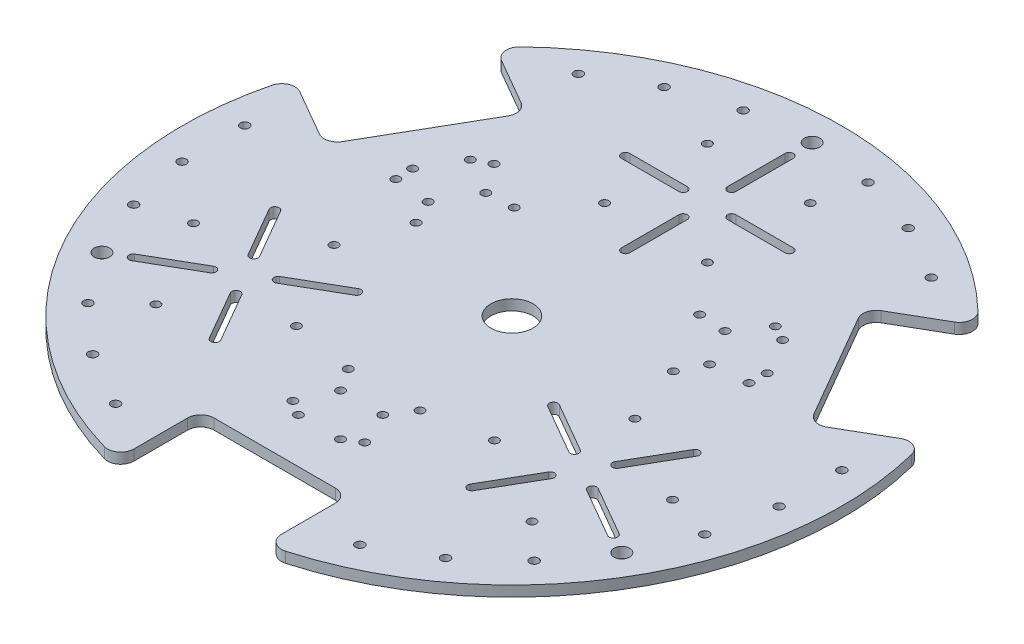
from build123d import *

# Parameters (mm, degrees)
SKETCH1_R           = 8
SKETCH1_R_2         = 2.95
SKETCH1_R_3         = 1.675
SKETCH1_R_4         = 1.6
BOSS_EXTRUDE2_DEPTH = 4
FILLET1_R           = 5


with BuildPart() as part:
    # Sketch1 → Boss-Extrude2 (new body)
    with BuildSketch(Plane(origin=(0, 0, 0), x_dir=(1, 0, 0), z_dir=(0, 1, 0))):
        with BuildLine():
            Line((-89.442286341, 25.081415713), (-66.442286341, 64.918584287))
            ThreePointArc((-66.442286341, 64.918584287), (-65.942784228, 68.712679513), (-68.27241336, 71.748711306))
            Line((-68.27241336, 71.748711306), (-91.502369642, 85.160532819))
            ThreePointArc((-91.502369642, 85.160532819), (0, 125), (91.502369642, 85.160532819))
            Line((91.502369642, 85.160532819), (68.27241336, 71.748711306))
            ThreePointArc((68.27241336, 71.748711306), (65.942784228, 68.712679513), (66.442286341, 64.918584287))
            Line((66.442286341, 64.918584287), (89.442286341, 25.081415713))
            ThreePointArc((89.442286341, 25.081415713), (92.478318134, 22.751786582), (96.27241336, 23.251288694))
            Line((96.27241336, 23.251288694), (119.502369642, 36.663110207))
            ThreePointArc((119.502369642, 36.663110207), (108.253175473, -62.5), (28, -121.823643025))
            Line((28, -121.823643025), (28, -95))
            ThreePointArc((28, -95), (26.535533906, -91.464466094), (23, -90))
            Line((23, -90), (-23, -90))
            ThreePointArc((-23, -90), (-26.535533906, -91.464466094), (-28, -95))
            Line((-28, -95), (-28, -121.823643025))
            ThreePointArc((-28, -121.823643025), (-108.253175473, -62.5), (-119.502369642, 36.663110207))
            Line((-119.502369642, 36.663110207), (-96.27241336, 23.251288694))
            ThreePointArc((-96.27241336, 23.251288694), (-92.478318134, 22.751786582), (-89.442286341, 25.081415713))
        make_face()
        with Locations(Location((0, 0, 0), (0, 0, 270))):
            Circle(SKETCH1_R, mode=Mode.SUBTRACT)
        with Locations(Location((0, 113.85, 0), (0, 0, 270))):
            Circle(SKETCH1_R_2, mode=Mode.SUBTRACT)
        with Locations(Location((98.596992221, -56.925, 0), (0, 0, 270))):
            Circle(SKETCH1_R_2, mode=Mode.SUBTRACT)
        with Locations(Location((-98.596992221, -56.925, 0), (0, 0, 270))):
            Circle(SKETCH1_R_2, mode=Mode.SUBTRACT)
        with Locations(Location((23.670746, 111.362104344, 0), (0, 0, 270))):
            Circle(SKETCH1_R_3, mode=Mode.SUBTRACT)
        with Locations(Location((46.306966814, 104.007150353, 0), (0, 0, 270))):
            Circle(SKETCH1_R_3, mode=Mode.SUBTRACT)
        with Locations(Location((66.919350973, 92.10658481, 0), (0, 0, 270))):
            Circle(SKETCH1_R_3, mode=Mode.SUBTRACT)
        with Locations(Location((113.226317788, 11.900565543, 0), (0, 0, 270))):
            Circle(SKETCH1_R_3, mode=Mode.SUBTRACT)
        with Locations(Location((113.226317788, -11.900565543, 0), (0, 0, 270))):
            Circle(SKETCH1_R_3, mode=Mode.SUBTRACT)
        with Locations(Location((108.27778438, -35.18158481, 0), (0, 0, 270))):
            Circle(SKETCH1_R_3, mode=Mode.SUBTRACT)
        with Locations(Location((84.607038381, -76.180519534, 0), (0, 0, 270))):
            Circle(SKETCH1_R_3, mode=Mode.SUBTRACT)
        with Locations(Location((66.919350974, -92.10658481, 0), (0, 0, 270))):
            Circle(SKETCH1_R_3, mode=Mode.SUBTRACT)
        with Locations(Location((46.306966814, -104.007150353, 0), (0, 0, 270))):
            Circle(SKETCH1_R_3, mode=Mode.SUBTRACT)
        with Locations(Location((-46.306966814, -104.007150353, 0), (0, 0, 270))):
            Circle(SKETCH1_R_3, mode=Mode.SUBTRACT)
        with Locations(Location((-66.919350973, -92.10658481, 0), (0, 0, 270))):
            Circle(SKETCH1_R_3, mode=Mode.SUBTRACT)
        with Locations(Location((-84.607038381, -76.180519534, 0), (0, 0, 270))):
            Circle(SKETCH1_R_3, mode=Mode.SUBTRACT)
        with Locations(Location((-108.27778438, -35.18158481, 0), (0, 0, 270))):
            Circle(SKETCH1_R_3, mode=Mode.SUBTRACT)
        with Locations(Location((-113.226317788, -11.900565543, 0), (0, 0, 270))):
            Circle(SKETCH1_R_3, mode=Mode.SUBTRACT)
        with Locations(Location((-113.226317788, 11.900565543, 0), (0, 0, 270))):
            Circle(SKETCH1_R_3, mode=Mode.SUBTRACT)
        with Locations(Location((-66.919350973, 92.10658481, 0), (0, 0, 270))):
            Circle(SKETCH1_R_3, mode=Mode.SUBTRACT)
        with Locations(Location((-46.306966814, 104.007150353, 0), (0, 0, 270))):
            Circle(SKETCH1_R_3, mode=Mode.SUBTRACT)
        with Locations(Location((-23.670746, 111.362104344, 0), (0, 0, 270))):
            Circle(SKETCH1_R_3, mode=Mode.SUBTRACT)
        with Locations(Location((-90.831628429, -29.925004626, 0), (0, 0, 270))):
            Circle(SKETCH1_R_4, mode=Mode.SUBTRACT)
        with Locations(Location((-57.056637682, -10.425004626, 0), (0, 0, 270))):
            Circle(SKETCH1_R_4, mode=Mode.SUBTRACT)
        with Locations(Location((-37.556637682, -44.199995374, 0), (0, 0, 270))):
            Circle(SKETCH1_R_4, mode=Mode.SUBTRACT)
        with Locations(Location((-71.331628429, -63.699995374, 0), (0, 0, 270))):
            Circle(SKETCH1_R_4, mode=Mode.SUBTRACT)
        with Locations(Location((19.5, 93.625, 0), (0, 0, 270))):
            Circle(SKETCH1_R_4, mode=Mode.SUBTRACT)
        with Locations(Location((19.5, 54.625, 0), (0, 0, 270))):
            Circle(SKETCH1_R_4, mode=Mode.SUBTRACT)
        with Locations(Location((-19.5, 54.625, 0), (0, 0, 270))):
            Circle(SKETCH1_R_4, mode=Mode.SUBTRACT)
        with Locations(Location((-19.5, 93.625, 0), (0, 0, 270))):
            Circle(SKETCH1_R_4, mode=Mode.SUBTRACT)
        with Locations(Location((71.331628429, -63.699995374, 0), (0, 0, 270))):
            Circle(SKETCH1_R_4, mode=Mode.SUBTRACT)
        with Locations(Location((37.556637682, -44.199995374, 0), (0, 0, 270))):
            Circle(SKETCH1_R_4, mode=Mode.SUBTRACT)
        with Locations(Location((57.056637682, -10.425004626, 0), (0, 0, 270))):
            Circle(SKETCH1_R_4, mode=Mode.SUBTRACT)
        with Locations(Location((90.831628429, -29.925004626, 0), (0, 0, 270))):
            Circle(SKETCH1_R_4, mode=Mode.SUBTRACT)
        with Locations(Location((-13.625, -48.465, 0), (0, 0, 270))):
            Circle(SKETCH1_R_4, mode=Mode.SUBTRACT)
        with Locations(Location((13.625, -48.465, 0), (0, 0, 270))):
            Circle(SKETCH1_R_4, mode=Mode.SUBTRACT)
        with Locations(Location((13.625, -69.465, 0), (0, 0, 270))):
            Circle(SKETCH1_R_4, mode=Mode.SUBTRACT)
        with Locations(Location((-13.625, -69.465, 0), (0, 0, 270))):
            Circle(SKETCH1_R_4, mode=Mode.SUBTRACT)
        with Locations(Location((-35.159421194, 36.032096127, 0), (0, 0, 270))):
            Circle(SKETCH1_R_4, mode=Mode.SUBTRACT)
        with Locations(Location((-48.784421194, 12.432903873, 0), (0, 0, 270))):
            Circle(SKETCH1_R_4, mode=Mode.SUBTRACT)
        with Locations(Location((-66.970954674, 22.932903873, 0), (0, 0, 270))):
            Circle(SKETCH1_R_4, mode=Mode.SUBTRACT)
        with Locations(Location((-53.345954674, 46.532096127, 0), (0, 0, 270))):
            Circle(SKETCH1_R_4, mode=Mode.SUBTRACT)
        with Locations(Location((48.784421194, 12.432903873, 0), (0, 0, 270))):
            Circle(SKETCH1_R_4, mode=Mode.SUBTRACT)
        with Locations(Location((35.159421194, 36.032096127, 0), (0, 0, 270))):
            Circle(SKETCH1_R_4, mode=Mode.SUBTRACT)
        with Locations(Location((53.345954674, 46.532096127, 0), (0, 0, 270))):
            Circle(SKETCH1_R_4, mode=Mode.SUBTRACT)
        with Locations(Location((66.970954674, 22.932903873, 0), (0, 0, 270))):
            Circle(SKETCH1_R_4, mode=Mode.SUBTRACT)
        with Locations(Location((-8, -73, 0), (0, 0, 270))):
            Circle(SKETCH1_R_4, mode=Mode.SUBTRACT)
        with Locations(Location((-8, -57, 0), (0, 0, 270))):
            Circle(SKETCH1_R_4, mode=Mode.SUBTRACT)
        with Locations(Location((8, -57, 0), (0, 0, 270))):
            Circle(SKETCH1_R_4, mode=Mode.SUBTRACT)
        with Locations(Location((8, -73, 0), (0, 0, 270))):
            Circle(SKETCH1_R_4, mode=Mode.SUBTRACT)
        with Locations(Location((-59.219854476, 43.42820323, 0), (0, 0, 270))):
            Circle(SKETCH1_R_4, mode=Mode.SUBTRACT)
        with Locations(Location((-45.363448016, 35.42820323, 0), (0, 0, 270))):
            Circle(SKETCH1_R_4, mode=Mode.SUBTRACT)
        with Locations(Location((-53.363448016, 21.57179677, 0), (0, 0, 270))):
            Circle(SKETCH1_R_4, mode=Mode.SUBTRACT)
        with Locations(Location((-67.219854476, 29.57179677, 0), (0, 0, 270))):
            Circle(SKETCH1_R_4, mode=Mode.SUBTRACT)
        with Locations(Location((67.219854476, 29.57179677, 0), (0, 0, 270))):
            Circle(SKETCH1_R_4, mode=Mode.SUBTRACT)
        with Locations(Location((53.363448016, 21.57179677, 0), (0, 0, 270))):
            Circle(SKETCH1_R_4, mode=Mode.SUBTRACT)
        with Locations(Location((45.363448016, 35.42820323, 0), (0, 0, 270))):
            Circle(SKETCH1_R_4, mode=Mode.SUBTRACT)
        with Locations(Location((59.219854476, 43.42820323, 0), (0, 0, 270))):
            Circle(SKETCH1_R_4, mode=Mode.SUBTRACT)
        with BuildLine():
            Line((-71.383217405, -43.060640646), (-90.262571208, -53.960640646))
            ThreePointArc((-90.262571208, -53.960640646), (-92.448211854, -53.375), (-91.862571208, -51.189359354))
            Line((-91.862571208, -51.189359354), (-72.983217405, -40.289359354))
            ThreePointArc((-72.983217405, -40.289359354), (-70.797576759, -40.875), (-71.383217405, -43.060640646))
        make_face(mode=Mode.SUBTRACT)
        with BuildLine():
            Line((-70.192273702, -29.87341565), (-81.092273702, -10.994061848))
            ThreePointArc((-81.092273702, -10.994061848), (-80.506633056, -8.808421202), (-78.320992409, -9.394061848))
            Line((-78.320992409, -9.394061848), (-67.420992409, -28.27341565))
            ThreePointArc((-67.420992409, -28.27341565), (-68.006633056, -30.459056296), (-70.192273702, -29.87341565))
        make_face(mode=Mode.SUBTRACT)
        with BuildLine():
            Line((-57.005048706, -31.064359354), (-38.125694903, -20.164359354))
            ThreePointArc((-38.125694903, -20.164359354), (-35.940054257, -20.75), (-36.525694903, -22.935640646))
            Line((-36.525694903, -22.935640646), (-55.405048706, -33.835640646))
            ThreePointArc((-55.405048706, -33.835640646), (-57.590689352, -33.25), (-57.005048706, -31.064359354))
        make_face(mode=Mode.SUBTRACT)
        with BuildLine():
            Line((-58.195992409, -44.25158435), (-47.295992409, -63.130938152))
            ThreePointArc((-47.295992409, -63.130938152), (-47.881633056, -65.316578798), (-50.067273702, -64.730938152))
            Line((-50.067273702, -64.730938152), (-60.967273702, -45.85158435))
            ThreePointArc((-60.967273702, -45.85158435), (-60.381633056, -43.665943704), (-58.195992409, -44.25158435))
        make_face(mode=Mode.SUBTRACT)
        with BuildLine():
            Line((-1.6, 83.35), (-1.6, 105.15))
            ThreePointArc((-1.6, 105.15), (0, 106.75), (1.6, 105.15))
            Line((1.6, 105.15), (1.6, 83.35))
            ThreePointArc((1.6, 83.35), (0, 81.75), (-1.6, 83.35))
        make_face(mode=Mode.SUBTRACT)
        with BuildLine():
            Line((-1.6, 43.1), (-1.6, 64.9))
            ThreePointArc((-1.6, 64.9), (0, 66.5), (1.6, 64.9))
            Line((1.6, 64.9), (1.6, 43.1))
            ThreePointArc((1.6, 43.1), (0, 41.5), (-1.6, 43.1))
        make_face(mode=Mode.SUBTRACT)
        with BuildLine():
            Line((9.225, 75.725), (31.025, 75.725))
            ThreePointArc((31.025, 75.725), (32.625, 74.125), (31.025, 72.525))
            Line((31.025, 72.525), (9.225, 72.525))
            ThreePointArc((9.225, 72.525), (7.625, 74.125), (9.225, 75.725))
        make_face(mode=Mode.SUBTRACT)
        with BuildLine():
            Line((-9.225, 72.525), (-31.025, 72.525))
            ThreePointArc((-31.025, 72.525), (-32.625, 74.125), (-31.025, 75.725))
            Line((-31.025, 75.725), (-9.225, 75.725))
            ThreePointArc((-9.225, 75.725), (-7.625, 74.125), (-9.225, 72.525))
        make_face(mode=Mode.SUBTRACT)
        with BuildLine():
            Line((72.983217405, -40.289359354), (91.862571208, -51.189359354))
            ThreePointArc((91.862571208, -51.189359354), (92.448211854, -53.375), (90.262571208, -53.960640646))
            Line((90.262571208, -53.960640646), (71.383217405, -43.060640646))
            ThreePointArc((71.383217405, -43.060640646), (70.797576759, -40.875), (72.983217405, -40.289359354))
        make_face(mode=Mode.SUBTRACT)
        with BuildLine():
            Line((38.125694903, -20.164359354), (57.005048706, -31.064359354))
            ThreePointArc((57.005048706, -31.064359354), (57.590689352, -33.25), (55.405048706, -33.835640646))
            Line((55.405048706, -33.835640646), (36.525694903, -22.935640646))
            ThreePointArc((36.525694903, -22.935640646), (35.940054257, -20.75), (38.125694903, -20.164359354))
        make_face(mode=Mode.SUBTRACT)
        with BuildLine():
            Line((60.967273702, -45.85158435), (50.067273702, -64.730938152))
            ThreePointArc((50.067273702, -64.730938152), (47.881633056, -65.316578798), (47.295992409, -63.130938152))
            Line((47.295992409, -63.130938152), (58.195992409, -44.25158435))
            ThreePointArc((58.195992409, -44.25158435), (60.381633056, -43.665943704), (60.967273702, -45.85158435))
        make_face(mode=Mode.SUBTRACT)
        with BuildLine():
            Line((67.420992409, -28.27341565), (78.320992409, -9.394061848))
            ThreePointArc((78.320992409, -9.394061848), (80.506633056, -8.808421202), (81.092273702, -10.994061848))
            Line((81.092273702, -10.994061848), (70.192273702, -29.87341565))
            ThreePointArc((70.192273702, -29.87341565), (68.006633056, -30.459056296), (67.420992409, -28.27341565))
        make_face(mode=Mode.SUBTRACT)
    extrude(amount=BOSS_EXTRUDE2_DEPTH)

    # Fillet1
    fillet1_edges = [part.edges().sort_by_distance(p)[0] for p in [
        (-28, 2, 121.823643025),
        (-119.502369642, 2, -36.663110207),
        (-91.502369642, 2, -85.160532819),
        (91.502369642, 2, -85.160532819),
        (119.502369642, 2, -36.663110207),
        (28, 2, 121.823643025),
    ]]
    fillet(fillet1_edges, radius=FILLET1_R)


solid = part.part
